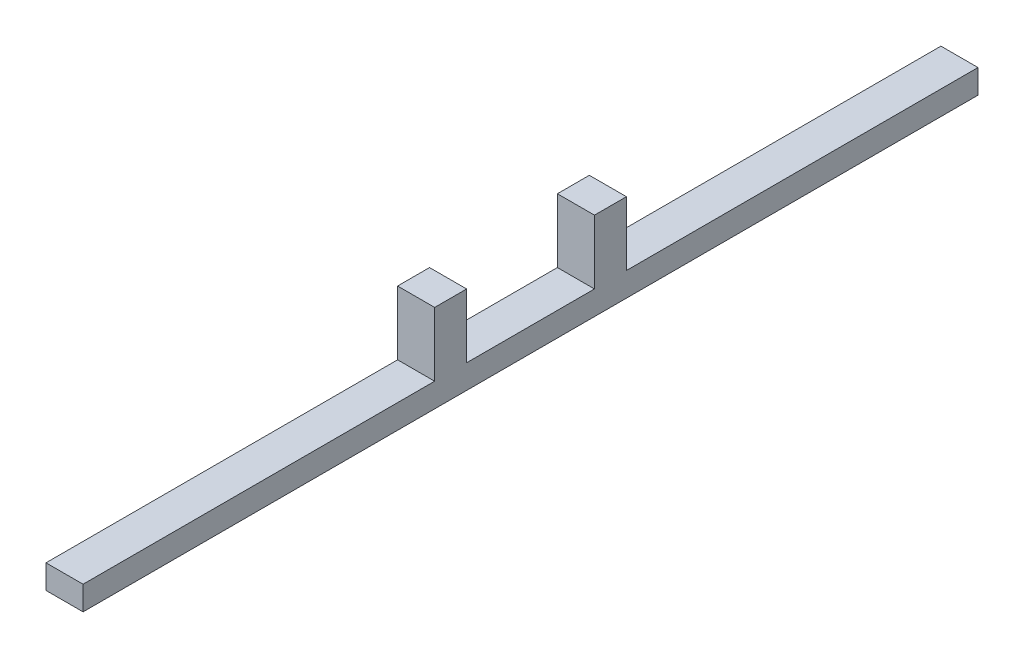
from build123d import *

# Parameters (mm, degrees)
SKETCH1_W           = 29.464
SKETCH1_H           = 19.05
BOSS_EXTRUDE1_DEPTH = 355.6
SKETCH2_W           = 29.464
SKETCH2_H           = 25.4
BOSS_EXTRUDE2_DEPTH = 50.8


with BuildPart() as part:
    # Sketch1 → Boss-Extrude1 (new, symmetric)
    with BuildSketch(Plane.XY):
        with Locations((0, -9.525)):
            Rectangle(SKETCH1_W, SKETCH1_H)
    extrude(amount=BOSS_EXTRUDE1_DEPTH, both=True)

    # Sketch2 → Boss-Extrude2 (add)
    with BuildSketch(Plane(origin=(0, 0, 0), x_dir=(1, 0, 0), z_dir=(0, 1, 0))):
        with Locations((0, 63.5)):
            Rectangle(SKETCH2_W, SKETCH2_H)
        with Locations((0, -63.5)):
            Rectangle(SKETCH2_W, SKETCH2_H)
    extrude(amount=BOSS_EXTRUDE2_DEPTH)


solid = part.part
